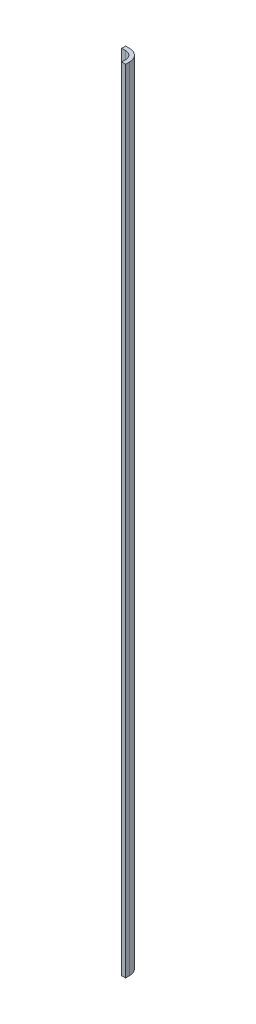
from build123d import *

# Parameters (mm, degrees)
BOSS_EXTRUDE1_DEPTH = 400


with BuildPart() as part:
    # Sketch1 → Boss-Extrude1 (new body)
    with BuildSketch(Plane(origin=(0, 0, 0), x_dir=(1, 0, 0), z_dir=(0, 1, 0))):
        with BuildLine():
            Line((39.160026276, 28.415916475), (39.160026276, 26.415916475))
            Line((39.160026276, 26.415916475), (37.160026276, 26.415916475))
            Line((37.160026276, 26.415916475), (37.160026276, 28.415916475))
            ThreePointArc((37.160026276, 28.415916475), (35.9884534, 31.2443436), (33.160026276, 32.415916475))
            Line((33.160026276, 32.415916475), (31.160026276, 32.415916475))
            Line((31.160026276, 32.415916475), (31.160026276, 34.415916475))
            Line((31.160026276, 34.415916475), (33.160026276, 34.415916475))
            ThreePointArc((33.160026276, 34.415916475), (37.402666963, 32.658557162), (39.160026276, 28.415916475))
        make_face()
    extrude(amount=BOSS_EXTRUDE1_DEPTH)


solid = part.part
